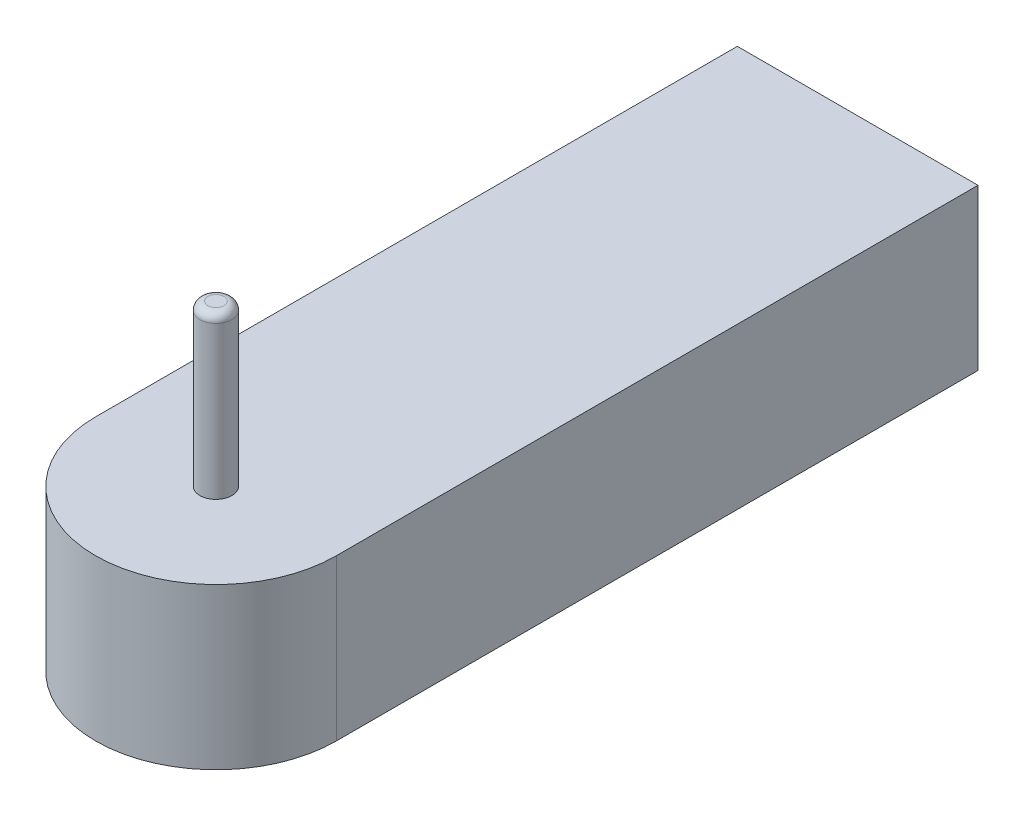
from build123d import *

# Parameters (mm, degrees)
EXTRUDE_1_DEPTH = 100
SKETCH_2_R      = 10
EXTRUDE_2_DEPTH = 100
FILLET_1_R      = 5


with BuildPart() as part:
    # 草图1 → 凸台-拉伸1 (new body)
    with BuildSketch(Plane(origin=(0, 0, 0), x_dir=(1, 0, 0), z_dir=(0, 1, 0))):
        with BuildLine():
            Line((0, 0), (150, 0))
            Line((150, 0), (150, -400))
            ThreePointArc((150, -400), (75, -475), (0, -400))
            Line((0, -400), (0, 0))
        make_face()
    extrude(amount=EXTRUDE_1_DEPTH)

    # 草图2 → 凸台-拉伸2 (add)
    with BuildSketch(Plane(origin=(0, 100, 0), x_dir=(1, 0, 0), z_dir=(0, 1, 0))):
        with Locations(Location((75, -400, 0), (0, 0, 270))):
            Circle(SKETCH_2_R)
    extrude(amount=EXTRUDE_2_DEPTH)

    # 圆角1
    fillet_1_edges = [part.edges().sort_by_distance(p)[0] for p in [
        (75, 200, 390),
    ]]
    fillet(fillet_1_edges, radius=FILLET_1_R)


solid = part.part
